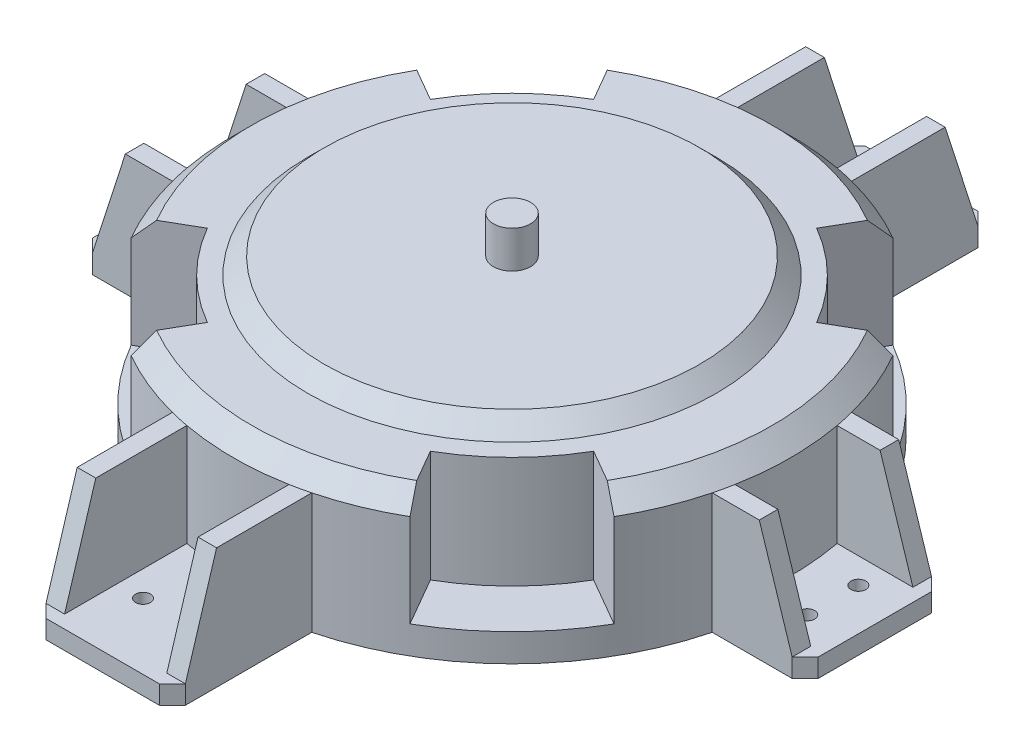
from build123d import *

# Parameters (mm, degrees)
SKETCH1_R            = 150
BOSS_EXTRUDE1_DEPTH  = 75
CHAMFER1_SIZE        = 10
BOSS_EXTRUDE2_START  = -75
BOSS_EXTRUDE2_DEPTH  = 10
CHAMFER2_SIZE        = 7
BOSS_EXTRUDE3_DEPTH  = 10
SKETCH7_R            = 4
CUT_EXTRUDE1_DEPTH   = 255.641782801
BOSS_EXTRUDE4_START  = 0.1
BOSS_EXTRUDE4_DEPTH  = 0.1
BOSS_EXTRUDE8_START  = -75
BOSS_EXTRUDE8_DEPTH  = 10
CHAMFER3_SIZE        = 7
BOSS_EXTRUDE9_DEPTH  = 10
SKETCH16_R           = 4
CUT_EXTRUDE2_DEPTH   = 302.407894506
CHAMFER4_SIZE        = 7
BOSS_EXTRUDE10_DEPTH = 10
SKETCH19_R           = 4
CUT_EXTRUDE3_DEPTH   = 302.407894506
BOSS_EXTRUDE11_START = -75
BOSS_EXTRUDE11_DEPTH = 10
CHAMFER5_SIZE        = 7
BOSS_EXTRUDE12_DEPTH = 10
SKETCH22_R           = 4
CUT_EXTRUDE4_DEPTH   = 302.407894506
CUT_EXTRUDE5_START   = -60
CUT_EXTRUDE5_DEPTH   = 60
CIRPATTERN31_COUNT   = 4
SKETCH24_R           = 110
BOSS_EXTRUDE13_DEPTH = 9
BOSS_EXTRUDE13_TAPER = 45
SKETCH25_R           = 10
BOSS_EXTRUDE14_DEPTH = 20
SKETCH28_R           = 4
CUT_EXTRUDE6_DEPTH   = 309.962325973


with BuildPart() as part:
    # Sketch1 → Boss-Extrude1 (new body)
    with BuildSketch(Plane(origin=(0, 0, 0), x_dir=(1, 0, 0), z_dir=(0, 1, 0))):
        with Locations(Location((0, 0, 0), (0, 0, 270))):
            Circle(SKETCH1_R)
    extrude(amount=BOSS_EXTRUDE1_DEPTH)

    # Chamfer1
    chamfer1_edges = [part.edges().sort_by_distance(p)[0] for p in [
        (0, 75, -150),
    ]]
    chamfer(chamfer1_edges, length=CHAMFER1_SIZE)

    # Sketch2 → Boss-Extrude2 (add)
    with BuildSketch(Plane(origin=(0, 75, 0), x_dir=(1, 0, 0), z_dir=(0, 1, 0)).offset(BOSS_EXTRUDE2_START)):
        with BuildLine():
            Line((-145.236875483, 37.5), (-195.236875483, 37.5))
            Line((-195.236875483, 37.5), (-195.236875483, -37.5))
            Line((-195.236875483, -37.5), (-145.236875483, -37.5))
            ThreePointArc((-145.236875483, -37.5), (-150, 0), (-145.236875483, 37.5))
        make_face()
    extrude(amount=BOSS_EXTRUDE2_DEPTH)

    # Chamfer2
    chamfer2_edges = [part.edges().sort_by_distance(p)[0] for p in [
        (-195.236875483, 5, 37.5),
        (-195.236875483, 5, -37.5),
    ]]
    chamfer(chamfer2_edges, length=CHAMFER2_SIZE)

    # Sketch6 → Boss-Extrude3 (add)
    with BuildSketch(Plane.XY.offset(37.5)):
        Polygon((-145.236875483, 0), (-145.236875483, 65), (-170.556875483, 65), (-188.236875483, 10), (-188.236875483, 0), align=None)
    boss_extrude3 = extrude(amount=-BOSS_EXTRUDE3_DEPTH)

    # Sketch7 → Cut-Extrude1 (cut, through all)
    with BuildSketch(Plane(origin=(0, 10, 0), x_dir=(1, 0, 0), z_dir=(0, 1, 0))):
        with Locations(Location((-172.618437741, -13.75, 0), (0, 0, 270))):
            Circle(SKETCH7_R)
    cut_extrude1 = extrude(amount=-CUT_EXTRUDE1_DEPTH, mode=Mode.SUBTRACT)

    # Mirror2: Boss-Extrude3, Cut-Extrude1 across plane
    add(boss_extrude3.mirror(Plane.XY))
    add(cut_extrude1.mirror(Plane.XY), mode=Mode.SUBTRACT)

    # Sketch10 → Boss-Extrude4 (add)
    with BuildSketch(Plane.XZ.offset(BOSS_EXTRUDE4_START)):
        with BuildLine():
            Line((-145.236875483, 37.5), (-188.236875483, 37.5))
            Line((-188.236875483, 37.5), (-195.236875483, 30.5))
            Line((-195.236875483, 30.5), (-195.236875483, -30.5))
            Line((-195.236875483, -30.5), (-188.236875483, -37.5))
            Line((-188.236875483, -37.5), (-145.236875483, -37.5))
            ThreePointArc((-145.236875483, -37.5), (-150, 0), (-145.236875483, 37.5))
        make_face()
    extrude(amount=-BOSS_EXTRUDE4_DEPTH)

    # Sketch11 → Boss-Extrude8 (add)
    with BuildSketch(Plane(origin=(0, 75, 0), x_dir=(1, 0, 0), z_dir=(0, 1, 0)).offset(BOSS_EXTRUDE8_START)):
        with BuildLine():
            Line((37.5, 220.236875483), (37.5, 145.236875483))
            ThreePointArc((37.5, 145.236875483), (0, 150), (-37.5, 145.236875483))
            Line((-37.5, 145.236875483), (-37.5, 220.236875483))
            Line((-37.5, 220.236875483), (37.5, 220.236875483))
        make_face()
        with BuildLine():
            Line((37.5, -220.236875483), (37.5, -145.236875483))
            ThreePointArc((37.5, -145.236875483), (0, -150), (-37.5, -145.236875483))
            Line((-37.5, -145.236875483), (-37.5, -220.236875483))
            Line((-37.5, -220.236875483), (37.5, -220.236875483))
        make_face()
    extrude(amount=BOSS_EXTRUDE8_DEPTH)

    # Chamfer3
    chamfer3_edges = [part.edges().sort_by_distance(p)[0] for p in [
        (37.5, 5, -220.236875483),
        (-37.5, 5, -220.236875483),
    ]]
    chamfer(chamfer3_edges, length=CHAMFER3_SIZE)

    # Sketch14 → Boss-Extrude9 (add)
    with BuildSketch(Plane.ZY.offset(37.5)):
        Polygon((-145.236875483, 0), (-145.236875483, 65), (-195.556875483, 65), (-213.236875483, 10), (-213.236875483, 0), align=None)
    boss_extrude9 = extrude(amount=-BOSS_EXTRUDE9_DEPTH)

    # Mirror3: Boss-Extrude9 across plane
    add(boss_extrude9.mirror(Plane.ZY))

    # Sketch16 → Cut-Extrude2 (cut, through all)
    with BuildSketch(Plane(origin=(0, 10, 0), x_dir=(1, 0, 0), z_dir=(0, 1, 0))):
        with Locations(Location((-13.75, 185.118437741, 0), (0, 0, 270))):
            Circle(SKETCH16_R)
        with Locations(Location((13.75, 185.118437741, 0), (0, 0, 270))):
            Circle(SKETCH16_R)
    extrude(amount=-CUT_EXTRUDE2_DEPTH, mode=Mode.SUBTRACT)

    # Chamfer4
    chamfer4_edges = [part.edges().sort_by_distance(p)[0] for p in [
        (-37.5, 5, 220.236875483),
        (37.5, 5, 220.236875483),
    ]]
    chamfer(chamfer4_edges, length=CHAMFER4_SIZE)

    # Sketch18 → Boss-Extrude10 (add)
    with BuildSketch(Plane(origin=(37.5, 0, 0), x_dir=(0, 0, -1), z_dir=(1, 0, 0))):
        Polygon((-145.236875483, 0), (-145.236875483, 65), (-196.456875483, 65), (-213.236875483, 10), (-213.236875483, 0), align=None)
    boss_extrude10 = extrude(amount=-BOSS_EXTRUDE10_DEPTH)

    # Sketch19 → Cut-Extrude3 (cut, through all)
    with BuildSketch(Plane(origin=(0, 10, 0), x_dir=(1, 0, 0), z_dir=(0, 1, 0))):
        with Locations(Location((13.75, -184.771281751, 0), (0, 0, 270))):
            Circle(SKETCH19_R)
        with Locations(Location((-13.75, -184.771281751, 0), (0, 0, 270))):
            Circle(SKETCH19_R)
    extrude(amount=-CUT_EXTRUDE3_DEPTH, mode=Mode.SUBTRACT)

    # Mirror4: Boss-Extrude10 across plane
    add(boss_extrude10.mirror(Plane(origin=(0, 0, 0), x_dir=(0, 0, 1), z_dir=(1, 0, 0))))

    # Sketch20 → Boss-Extrude11 (add)
    with BuildSketch(Plane(origin=(0, 75, 0), x_dir=(1, 0, 0), z_dir=(0, 1, 0)).offset(BOSS_EXTRUDE11_START)):
        with BuildLine():
            Line((195.236875483, 37.5), (145.236875483, 37.5))
            ThreePointArc((145.236875483, 37.5), (150, 0), (145.236875483, -37.5))
            Line((145.236875483, -37.5), (195.236875483, -37.5))
            Line((195.236875483, -37.5), (195.236875483, 37.5))
        make_face()
    extrude(amount=BOSS_EXTRUDE11_DEPTH)

    # Chamfer5
    chamfer5_edges = [part.edges().sort_by_distance(p)[0] for p in [
        (195.236875483, 5, 37.5),
        (195.236875483, 5, -37.5),
    ]]
    chamfer(chamfer5_edges, length=CHAMFER5_SIZE)

    # Sketch21 → Boss-Extrude12 (add)
    with BuildSketch(Plane(origin=(0, 0, -37.5), x_dir=(-1, 0, 0), z_dir=(0, 0, -1))):
        Polygon((-145.236875483, 0), (-145.236875483, 65), (-170.556875483, 65), (-188.236875483, 10), (-188.236875483, 0), align=None)
    boss_extrude12 = extrude(amount=-BOSS_EXTRUDE12_DEPTH)

    # Sketch22 → Cut-Extrude4 (cut, through all)
    with BuildSketch(Plane(origin=(0, 10, 0), x_dir=(1, 0, 0), z_dir=(0, 1, 0))):
        with Locations(Location((172.618437741, 13.75, 0), (0, 0, 270))):
            Circle(SKETCH22_R)
    cut_extrude4 = extrude(amount=-CUT_EXTRUDE4_DEPTH, mode=Mode.SUBTRACT)

    # Mirror5: Boss-Extrude12, Cut-Extrude4 across plane
    add(boss_extrude12.mirror(Plane(origin=(0, 0, 0), x_dir=(1, 0, 0), z_dir=(0, 0, -1))))
    add(cut_extrude4.mirror(Plane(origin=(0, 0, 0), x_dir=(1, 0, 0), z_dir=(0, 0, -1))), mode=Mode.SUBTRACT)

    # Sketch23 → Cut-Extrude5 (cut)
    with BuildSketch(Plane(origin=(0, 75, 0), x_dir=(1, 0, 0), z_dir=(0, 1, 0)).offset(CUT_EXTRUDE5_START)):
        with BuildLine():
            Line((-103.923048454, -60), (-129.903810568, -75))
            ThreePointArc((-129.903810568, -75), (-106.066017178, -106.066017178), (-75, -129.903810568))
            Line((-75, -129.903810568), (-60, -103.923048454))
            ThreePointArc((-60, -103.923048454), (-84.852813742, -84.852813742), (-103.923048454, -60))
        make_face()
    cut_extrude5 = extrude(amount=CUT_EXTRUDE5_DEPTH, mode=Mode.SUBTRACT)

    # CirPattern31: Cut-Extrude5 ×4 about axis
    cirpattern31_axis = Axis((0, 75, 0), (0, 1, 0))
    for i in range(1, CIRPATTERN31_COUNT):
        add(cut_extrude5.rotate(cirpattern31_axis, i * 360 / CIRPATTERN31_COUNT), mode=Mode.SUBTRACT)

    # Sketch24 → Boss-Extrude13 (add)
    with BuildSketch(Plane(origin=(0, 75, 0), x_dir=(1, 0, 0), z_dir=(0, 1, 0))):
        Circle(SKETCH24_R)
    extrude(amount=BOSS_EXTRUDE13_DEPTH, taper=BOSS_EXTRUDE13_TAPER)

    # Sketch25 → Boss-Extrude14 (add)
    with BuildSketch(Plane(origin=(0, 84, 0), x_dir=(1, 0, 0), z_dir=(0, 1, 0))):
        with Locations(Location((0, 0, 0), (0, 0, 270))):
            Circle(SKETCH25_R)
    extrude(amount=BOSS_EXTRUDE14_DEPTH)

    # Sketch28 → Cut-Extrude6 (cut, through all)
    with BuildSketch(Plane(origin=(0, 10, 0), x_dir=(1, 0, 0), z_dir=(0, 1, 0))):
        with Locations(Location((-172.618437741, 13.75, 0), (0, 0, 270))):
            Circle(SKETCH28_R)
        with Locations(Location((-172.618437741, -13.75, 0), (0, 0, 270))):
            Circle(SKETCH28_R)
    extrude(amount=-CUT_EXTRUDE6_DEPTH, mode=Mode.SUBTRACT)


solid = part.part
